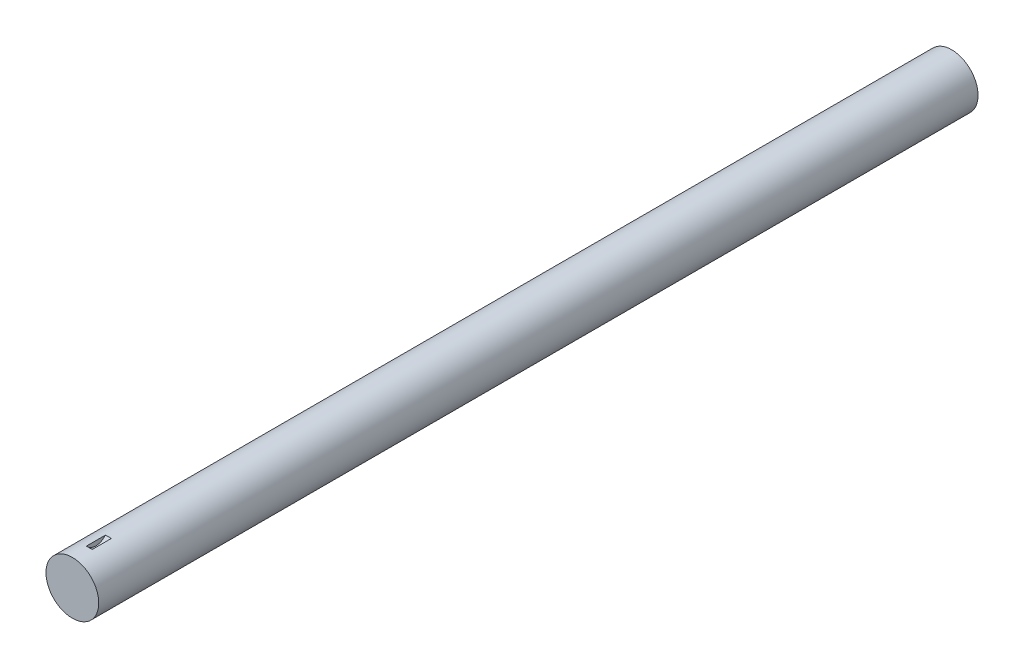
from build123d import *

# Parameters (mm, degrees)
SKETCH1_R           = 9
BOSS_EXTRUDE1_DEPTH = 50
CUT_EXTRUDE1_DEPTH  = 1
SKETCH3_R           = 9
BOSS_EXTRUDE2_DEPTH = 200


with BuildPart() as part:
    # Sketch1 → Boss-Extrude1 (new, symmetric)
    with BuildSketch(Plane.XY):
        Circle(SKETCH1_R)
    extrude(amount=BOSS_EXTRUDE1_DEPTH, both=True)

    # Sketch2 → Cut-Extrude1 (cut, symmetric)
    with BuildSketch(Plane(origin=(0, 0, 0), x_dir=(0, 0, -1), z_dir=(1, 0, 0))):
        with BuildLine():
            Line((-45, 10.5), (-37, 10.5))
            ThreePointArc((-37, 10.5), (-41, 7.376894374), (-45, 10.5))
        make_face()
    extrude(amount=CUT_EXTRUDE1_DEPTH, both=True, mode=Mode.SUBTRACT)

    # Sketch3 → Boss-Extrude2 (add)
    with BuildSketch(Plane(origin=(0, 0, -50), x_dir=(-1, 0, 0), z_dir=(0, 0, -1))):
        Circle(SKETCH3_R)
    extrude(amount=BOSS_EXTRUDE2_DEPTH)


solid = part.part
